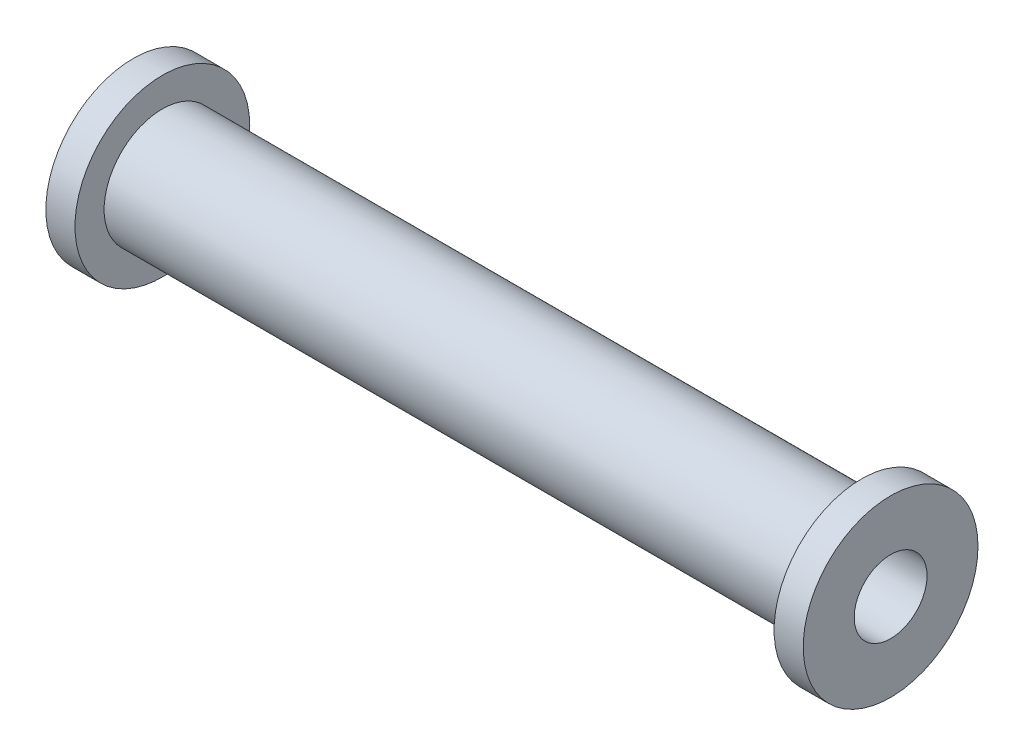
from build123d import *

# Parameters (mm, degrees)
SKETCH1_R           = 3
SKETCH1_R_2         = 1.25
BOSS_EXTRUDE2_DEPTH = 1
SKETCH2_R           = 2
SKETCH2_R_2         = 1.25
BOSS_EXTRUDE3_DEPTH = 24
SKETCH3_R           = 3
SKETCH3_R_2         = 1.25
BOSS_EXTRUDE4_DEPTH = 1


with BuildPart() as part:
    # Sketch1 → Boss-Extrude2 (new body)
    with BuildSketch(Plane(origin=(0, 0, 0), x_dir=(0, 0, -1), z_dir=(1, 0, 0))):
        Circle(SKETCH1_R)
        Circle(SKETCH1_R_2, mode=Mode.SUBTRACT)
    extrude(amount=BOSS_EXTRUDE2_DEPTH)

    # Sketch2 → Boss-Extrude3 (add)
    with BuildSketch(Plane(origin=(1, 0, 0), x_dir=(0, 0, -1), z_dir=(1, 0, 0))):
        Circle(SKETCH2_R)
        Circle(SKETCH2_R_2, mode=Mode.SUBTRACT)
    extrude(amount=BOSS_EXTRUDE3_DEPTH)

    # Sketch3 → Boss-Extrude4 (add)
    with BuildSketch(Plane(origin=(25, 0, 0), x_dir=(0, 0, -1), z_dir=(1, 0, 0))):
        Circle(SKETCH3_R)
        Circle(SKETCH3_R_2, mode=Mode.SUBTRACT)
    extrude(amount=BOSS_EXTRUDE4_DEPTH)


solid = part.part
